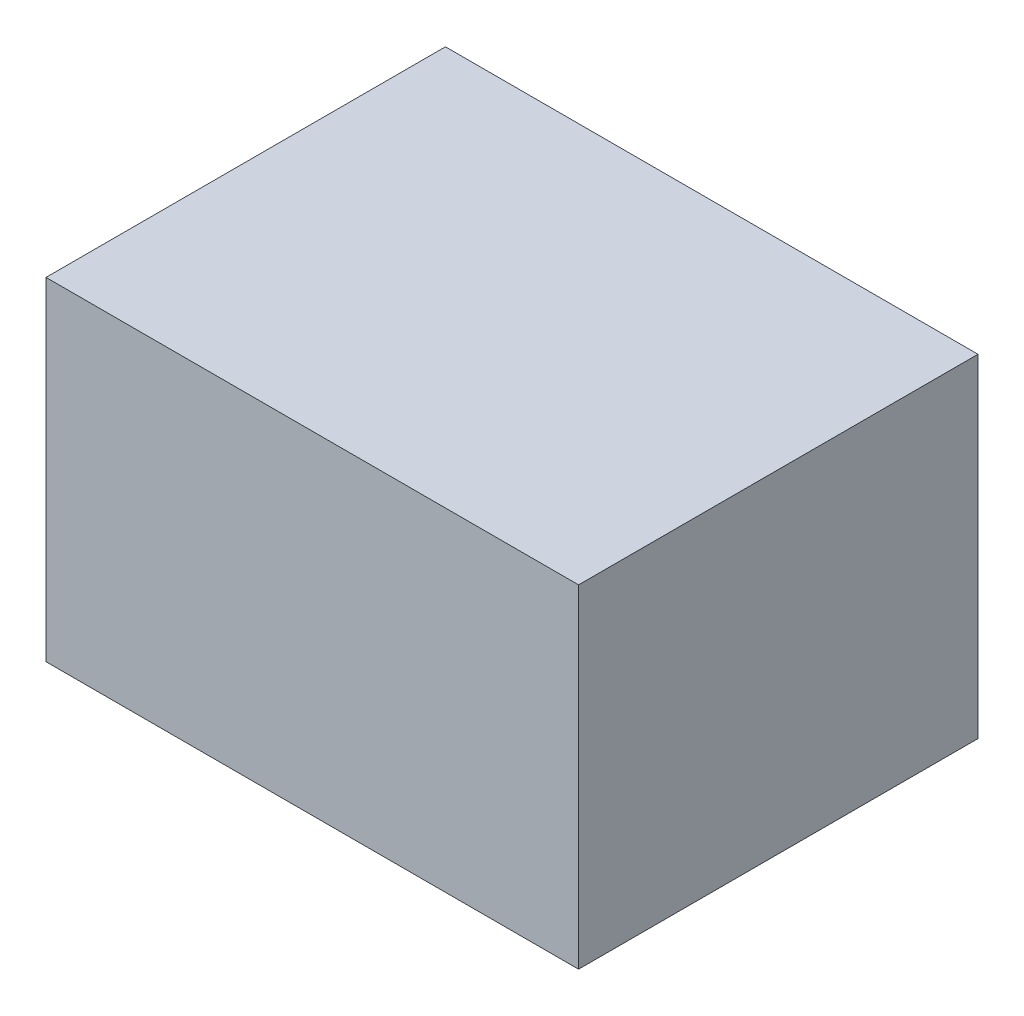
from build123d import *

# Parameters (mm, degrees)
SKETCH1_W               = 1.999996
SKETCH1_H               = 1.2499848
COMPONENT_OUTLINE_DEPTH = 1.499997


with BuildPart() as part:
    # Sketch1 → Component_Outline (new body)
    with BuildSketch(Plane.XY):
        Rectangle(SKETCH1_W, SKETCH1_H)
    extrude(amount=COMPONENT_OUTLINE_DEPTH)


solid = part.part
